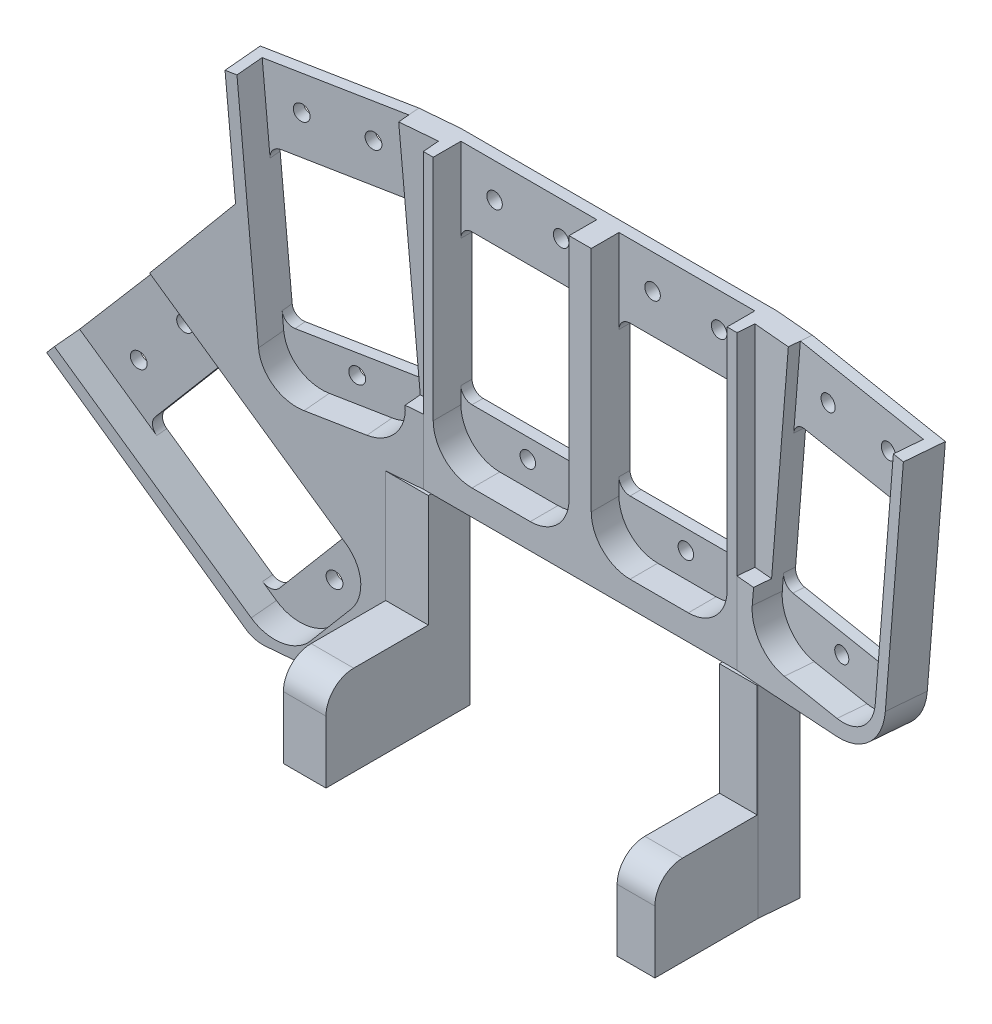
from build123d import *

# Parameters (mm, degrees)
EXTRUDE_3_DEPTH           = 2
EXTRUDE_4_DEPTH           = 5
SKETCH_5_R                = 1.4
CUT_EXTRUDE_1_DEPTH       = 5
EXTRUDE_5_DEPTH           = 52.129230191
SKETCH_8_R                = 1.4
CUT_EXTRUDE_2_DEPTH       = 54
EXTRUDE_6_DEPTH           = 5
EXTRUDE_7_DEPTH           = 52.129230191
EXTRUDE_8_DEPTH           = 5
SKETCH_12_R               = 1.4
CUT_EXTRUDE_3_DEPTH       = 5
EXTRUDE_9_DEPTH           = 48
SKETCH_16_W               = 1.992389396
SKETCH_16_H               = 100.129230191
EXTRUDE_10_DEPTH          = 31
EXTRUDE_12_DEPTH          = 5
SKETCH_20_R               = 1.4
CUT_EXTRUDE_4_DEPTH       = 5
SKETCH_22_R               = 1.4
CUT_EXTRUDE_5_DEPTH       = 126.647084661
CUT_EXTRUDE_6_DEPTH       = 126.647084661
CUT_EXTRUDE_7_DEPTH       = 126.549675565
SKETCH_25_W               = 6.808711464
SKETCH_25_H               = 36.46101183
SKETCH_25_W_2             = 7.679638845
EXTRUDE_14_DEPTH          = 19
CUT_EXTRUDE_8_DEPTH       = 123.081566263
CUT_EXTRUDE_8_DEPTH_BACK  = 123.081566263
SKETCH_26_W               = 24.786483996
SKETCH_26_H               = 10.930361431
SKETCH_26_W_2             = 52.20763572
SKETCH_26_W_3             = 6.238333061
CUT_EXTRUDE_9_DEPTH       = 116.857490947
CUT_EXTRUDE_10_DEPTH      = 118.224183567
CUT_EXTRUDE_11_DEPTH      = 118.323637126
CUT_EXTRUDE_11_DEPTH_BACK = 118.323637126
CUT_EXTRUDE_13_DEPTH      = 118.224183567
CUT_EXTRUDE_13_DEPTH_BACK = 118.224183567
CUT_EXTRUDE_15_DEPTH      = 3
CUT_EXTRUDE_16_DEPTH      = 3
SKETCH_35_W               = 52.511649691
SKETCH_35_H               = 36.46101183
CUT_EXTRUDE_18_DEPTH      = 11
SKETCH_36_R               = 1.4
CUT_EXTRUDE_19_DEPTH      = 5
FILLET_1_R                = 10
SKETCH_37_W               = 18.454216578
SKETCH_37_H               = 20.228048906
CUT_EXTRUDE_20_DEPTH      = 67
FILLET_2_R                = 5


with BuildPart() as part:
    # 草图1 → 凸台-拉伸3 (new body)
    with BuildSketch(Plane.XY):
        with BuildLine():
            ThreePointArc((-6.317132976, 11.564038584), (-6.902919414, 12.978252146), (-8.317132976, 13.564038584))
            Line((-8.317132976, 13.564038584), (-28.817132976, 13.564038584))
            ThreePointArc((-28.817132976, 13.564038584), (-30.231346538, 12.978252146), (-30.817132976, 11.564038584))
            Line((-30.817132976, 11.564038584), (-30.817132976, 26.719925459))
            Line((-30.817132976, 26.719925459), (-6.317132976, 26.719925459))
            Line((-6.317132976, 26.719925459), (-6.317132976, 11.564038584))
        make_face()
        with BuildLine():
            ThreePointArc((22.182867024, 11.564038584), (21.597080586, 12.978252146), (20.182867024, 13.564038584))
            Line((20.182867024, 13.564038584), (-0.317132976, 13.564038584))
            ThreePointArc((-0.317132976, 13.564038584), (-1.731346538, 12.978252146), (-2.317132976, 11.564038584))
            Line((-2.317132976, 11.564038584), (-2.317132976, 26.719925459))
            Line((-2.317132976, 26.719925459), (22.182867024, 26.719925459))
            Line((22.182867024, 26.719925459), (22.182867024, 11.564038584))
        make_face()
        with BuildLine():
            Line((-2.317132976, -11.435961416), (-2.317132976, -14.435961416))
            ThreePointArc((-2.317132976, -14.435961416), (-0.266880444, -19.385708885), (4.682867024, -21.435961416))
            Line((4.682867024, -21.435961416), (15.182867024, -21.435961416))
            ThreePointArc((15.182867024, -21.435961416), (20.132614492, -19.385708885), (22.182867024, -14.435961416))
            Line((22.182867024, -14.435961416), (22.182867024, -11.435961416))
            ThreePointArc((22.182867024, -11.435961416), (21.597080586, -12.850174979), (20.182867024, -13.435961416))
            Line((20.182867024, -13.435961416), (-0.317132976, -13.435961416))
            ThreePointArc((-0.317132976, -13.435961416), (-1.731346538, -12.850174979), (-2.317132976, -11.435961416))
        make_face()
        with BuildLine():
            Line((-30.817132976, -11.435961416), (-30.817132976, -14.435961416))
            ThreePointArc((-30.817132976, -14.435961416), (-28.766880444, -19.385708885), (-23.817132976, -21.435961416))
            Line((-23.817132976, -21.435961416), (-13.317132976, -21.435961416))
            ThreePointArc((-13.317132976, -21.435961416), (-8.367385508, -19.385708885), (-6.317132976, -14.435961416))
            Line((-6.317132976, -14.435961416), (-6.317132976, -11.435961416))
            ThreePointArc((-6.317132976, -11.435961416), (-6.902919414, -12.850174979), (-8.317132976, -13.435961416))
            Line((-8.317132976, -13.435961416), (-28.817132976, -13.435961416))
            ThreePointArc((-28.817132976, -13.435961416), (-30.231346538, -12.850174979), (-30.817132976, -11.435961416))
        make_face()
        with BuildLine():
            ThreePointArc((-2.317132976, -14.435961416), (-0.266880444, -19.385708885), (4.682867024, -21.435961416))
            Line((4.682867024, -21.435961416), (15.182867024, -21.435961416))
            ThreePointArc((15.182867024, -21.435961416), (20.132614492, -19.385708885), (22.182867024, -14.435961416))
            Line((22.182867024, -14.435961416), (22.182867024, -11.435961416))
            Line((22.182867024, -11.435961416), (22.182867024, 11.564038584))
            Line((22.182867024, 11.564038584), (22.182867024, 26.719925459))
            Line((22.182867024, 26.719925459), (24.182867024, 26.719925459))
            Line((24.182867024, 26.719925459), (24.182867024, -25.409304732))
            Line((24.182867024, -25.409304732), (-32.817132976, -25.409304732))
            Line((-32.817132976, -25.409304732), (-32.817132976, 26.719925459))
            Line((-32.817132976, 26.719925459), (-30.817132976, 26.719925459))
            Line((-30.817132976, 26.719925459), (-30.817132976, 11.564038584))
            Line((-30.817132976, 11.564038584), (-30.817132976, -11.435961416))
            Line((-30.817132976, -11.435961416), (-30.817132976, -14.435961416))
            ThreePointArc((-30.817132976, -14.435961416), (-28.766880444, -19.385708885), (-23.817132976, -21.435961416))
            Line((-23.817132976, -21.435961416), (-13.317132976, -21.435961416))
            ThreePointArc((-13.317132976, -21.435961416), (-8.367385508, -19.385708885), (-6.317132976, -14.435961416))
            Line((-6.317132976, -14.435961416), (-6.317132976, -11.435961416))
            Line((-6.317132976, -11.435961416), (-6.317132976, 11.564038584))
            Line((-6.317132976, 11.564038584), (-6.317132976, 26.719925459))
            Line((-6.317132976, 26.719925459), (-2.317132976, 26.719925459))
            Line((-2.317132976, 26.719925459), (-2.317132976, 11.564038584))
            Line((-2.317132976, 11.564038584), (-2.317132976, -11.435961416))
            Line((-2.317132976, -11.435961416), (-2.317132976, -14.435961416))
        make_face()
    extrude(amount=EXTRUDE_3_DEPTH)

    # 草图4 → 凸台-拉伸4 (add)
    with BuildSketch(Plane.XY.offset(2)):
        with BuildLine():
            Line((4.682867024, -21.435961416), (15.182867024, -21.435961416))
            ThreePointArc((15.182867024, -21.435961416), (20.132614492, -19.385708885), (22.182867024, -14.435961416))
            Line((22.182867024, -14.435961416), (22.182867024, -11.435961416))
            Line((22.182867024, -11.435961416), (22.182867024, 11.564038584))
            Line((22.182867024, 11.564038584), (22.182867024, 26.719925459))
            Line((22.182867024, 26.719925459), (24.182867024, 26.719925459))
            Line((24.182867024, 26.719925459), (24.182867024, -25.409304732))
            Line((24.182867024, -25.409304732), (-32.817132976, -25.409304732))
            Line((-32.817132976, -25.409304732), (-32.817132976, 26.719925459))
            Line((-32.817132976, 26.719925459), (-30.817132976, 26.719925459))
            Line((-30.817132976, 26.719925459), (-30.817132976, 11.564038584))
            Line((-30.817132976, 11.564038584), (-30.817132976, -11.435961416))
            Line((-30.817132976, -11.435961416), (-30.817132976, -14.435961416))
            ThreePointArc((-30.817132976, -14.435961416), (-28.766880444, -19.385708885), (-23.817132976, -21.435961416))
            Line((-23.817132976, -21.435961416), (-13.317132976, -21.435961416))
            ThreePointArc((-13.317132976, -21.435961416), (-8.367385508, -19.385708885), (-6.317132976, -14.435961416))
            Line((-6.317132976, -14.435961416), (-6.317132976, -11.435961416))
            Line((-6.317132976, -11.435961416), (-6.317132976, 11.564038584))
            Line((-6.317132976, 11.564038584), (-6.317132976, 26.719925459))
            Line((-6.317132976, 26.719925459), (-2.317132976, 26.719925459))
            Line((-2.317132976, 26.719925459), (-2.317132976, 11.564038584))
            Line((-2.317132976, 11.564038584), (-2.317132976, -11.435961416))
            Line((-2.317132976, -11.435961416), (-2.317132976, -14.435961416))
            ThreePointArc((-2.317132976, -14.435961416), (-0.266880444, -19.385708885), (4.682867024, -21.435961416))
        make_face()
    extrude(amount=EXTRUDE_4_DEPTH)

    # 草图5 → 切除-拉伸1 (cut)
    with BuildSketch(Plane.XY.offset(2)):
        with Locations((9.746956407, -16.935961416)):
            Circle(SKETCH_5_R)
        with Locations((-18.753043593, -16.935961416)):
            Circle(SKETCH_5_R)
        with Locations((-24.753043593, 20.564038584)):
            Circle(SKETCH_5_R)
        with Locations((-12.753043593, 20.564038584)):
            Circle(SKETCH_5_R)
        with Locations((3.746956407, 20.564038584)):
            Circle(SKETCH_5_R)
        with Locations((15.746956407, 20.564038584)):
            Circle(SKETCH_5_R)
    extrude(amount=-CUT_EXTRUDE_1_DEPTH, mode=Mode.SUBTRACT)

    # 草图7 → 凸台-拉伸5 (add)
    with BuildSketch(Plane(origin=(0, 26.719925459, 0), x_dir=(1, 0, 0), z_dir=(0, 1, 0))):
        Polygon((-32.817132976, 0), (-70.226687708, -3.272911947), (-70.05303953, -5.2577197), (-32.817132976, -2), align=None)
    extrude(amount=-EXTRUDE_5_DEPTH)

    # 草图8 → 切除-拉伸2 (cut)
    with BuildSketch(Plane(origin=(-0.075634817, 0, -0.864509916), x_dir=(0.9961946980917453, 0, -0.08715574274766177), z_dir=(0.08715574274766177, 0, 0.9961946980917453))):
        with Locations((-57.531809619, 18.980668109)):
            Circle(SKETCH_8_R)
        with Locations((-45.577473241, 20.026537022)):
            Circle(SKETCH_8_R)
        with Locations((-48.286301077, -17.853698613)):
            Circle(SKETCH_8_R)
        with BuildLine():
            Line((-38.381651523, 11.621711309), (-36.377069439, -11.290766747))
            ThreePointArc((-36.377069439, -11.290766747), (-36.837369949, -12.750653452), (-38.19514735, -13.457467629))
            Line((-38.19514735, -13.457467629), (-58.617138661, -15.244160355))
            ThreePointArc((-58.617138661, -15.244160355), (-60.077025366, -14.783859845), (-60.783839543, -13.426082445))
            Line((-60.783839543, -13.426082445), (-62.788421626, 9.486395612))
            ThreePointArc((-62.788421626, 9.486395612), (-62.328121116, 10.946282316), (-60.970343715, 11.653096493))
            Line((-60.970343715, 11.653096493), (-40.548352404, 13.43978922))
            ThreePointArc((-40.548352404, 13.43978922), (-39.088465699, 12.97948871), (-38.381651523, 11.621711309))
        make_face()
    extrude(amount=-CUT_EXTRUDE_2_DEPTH, mode=Mode.SUBTRACT)

    # 草图9 → 凸台-拉伸6 (add)
    with BuildSketch(Plane(origin=(-0.075634817, 0, -0.864509916), x_dir=(0.9961946980917453, 0, -0.08715574274766177), z_dir=(0.08715574274766177, 0, 0.9961946980917453))):
        with BuildLine():
            Line((-39.7025741, 26.719925459), (-38.381651523, 11.621711309))
            Line((-38.381651523, 11.621711309), (-36.377069439, -11.290766747))
            Line((-36.377069439, -11.290766747), (-36.115602211, -14.279350842))
            ThreePointArc((-36.115602211, -14.279350842), (-37.726653996, -19.388954309), (-42.478874898, -21.862803927))
            Line((-42.478874898, -21.862803927), (-52.938919228, -22.777939226))
            ThreePointArc((-52.938919228, -22.777939226), (-58.048522695, -21.166887441), (-60.522372314, -16.414666539))
            Line((-60.522372314, -16.414666539), (-60.783839543, -13.426082445))
            Line((-60.783839543, -13.426082445), (-62.788421626, 9.486395612))
            Line((-62.788421626, 9.486395612), (-64.29616012, 26.719925459))
            Line((-64.29616012, 26.719925459), (-66.29616012, 26.719925459))
            Line((-66.29616012, 26.719925459), (-61.73544344, -25.409304732))
            Line((-61.73544344, -25.409304732), (-32.866565363, -25.409304732))
            Line((-32.866565363, -25.409304732), (-32.866565363, 26.719925459))
            Line((-32.866565363, 26.719925459), (-39.7025741, 26.719925459))
        make_face()
    extrude(amount=EXTRUDE_6_DEPTH)

    # 草图10 → 凸台-拉伸7 (add)
    with BuildSketch(Plane(origin=(0, 26.719925459, 0), x_dir=(1, 0, 0), z_dir=(0, 1, 0))):
        Polygon((24.182867024, 0), (76.130717626, -4.544848022), (76.172198029, -6.548477087), (24.182867024, -2), align=None)
    extrude(amount=-EXTRUDE_7_DEPTH)

    # 草图11 → 凸台-拉伸8 (add)
    with BuildSketch(Plane(origin=(0.010047867, 0, -0.114847642), x_dir=(0.9961946980917452, 0, 0.08715574274766201), z_dir=(-0.08715574274766202, 0, 0.9961946980917453))):
        with BuildLine():
            Line((27.775659476, -11.290766747), (29.780241559, 11.621711309))
            Line((29.780241559, 11.621711309), (31.101164137, 26.719925459))
            Line((31.101164137, 26.719925459), (24.265155399, 26.719925459))
            Line((24.265155399, 26.719925459), (24.265155399, -25.409304732))
            Line((24.265155399, -25.409304732), (53.134033476, -25.409304732))
            Line((53.134033476, -25.409304732), (57.694750156, 26.719925459))
            Line((57.694750156, 26.719925459), (55.694750156, 26.719925459))
            Line((55.694750156, 26.719925459), (54.187011662, 9.486395612))
            Line((54.187011662, 9.486395612), (52.182429579, -13.426082445))
            Line((52.182429579, -13.426082445), (51.920962351, -16.414666539))
            ThreePointArc((51.920962351, -16.414666539), (49.447112732, -21.166887441), (44.337509265, -22.777939226))
            Line((44.337509265, -22.777939226), (33.877464935, -21.862803927))
            ThreePointArc((33.877464935, -21.862803927), (29.125244032, -19.388954309), (27.514192248, -14.279350842))
            Line((27.514192248, -14.279350842), (27.775659476, -11.290766747))
        make_face()
    extrude(amount=EXTRUDE_8_DEPTH)

    # 草图12 → 切除-拉伸3 (cut)
    with BuildSketch(Plane(origin=(0.010047867, 0, -0.114847642), x_dir=(0.9961946980917452, 0, 0.08715574274766201), z_dir=(-0.08715574274766202, 0, 0.9961946980917453))):
        with Locations((36.605656936, 20.058943377)):
            Circle(SKETCH_12_R)
        with Locations((48.559993313, 19.013074464)):
            Circle(SKETCH_12_R)
        with Locations((39.314484771, -17.821292257)):
            Circle(SKETCH_12_R)
        with BuildLine():
            Line((50.015728697, -15.244160355), (29.593737387, -13.457467629))
            ThreePointArc((29.593737387, -13.457467629), (28.235959986, -12.750653452), (27.775659476, -11.290766747))
            Line((27.775659476, -11.290766747), (29.780241559, 11.621711309))
            ThreePointArc((29.780241559, 11.621711309), (30.487055736, 12.97948871), (31.946942441, 13.43978922))
            Line((31.946942441, 13.43978922), (52.368933752, 11.653096493))
            ThreePointArc((52.368933752, 11.653096493), (53.726711152, 10.946282316), (54.187011662, 9.486395612))
            Line((54.187011662, 9.486395612), (52.182429579, -13.426082445))
            ThreePointArc((52.182429579, -13.426082445), (51.475615402, -14.783859845), (50.015728697, -15.244160355))
        make_face()
    extrude(amount=-CUT_EXTRUDE_3_DEPTH, mode=Mode.SUBTRACT)

    # 草图14 → 凸台-拉伸9 (add)
    with BuildSketch(Plane.XZ.offset(25.409304732)):
        Polygon((52.50611159, 9.497062002), (23.964562309, 7), (-32.598828262, 7), (-61.140377543, 9.497062002), (-61.576156256, 4.516088511), (-70.05303953, 5.2577197), (-70.226687708, 3.272911947), (-32.817132976, 0), (24.182867024, 0), (76.130717626, 4.544848022), (76.172198029, 6.548477087), (52.941890304, 4.516088511), align=None)
    extrude(amount=EXTRUDE_9_DEPTH)

    # 草图16 → 凸台-拉伸10 (add)
    with BuildSketch(Plane(origin=(-69.977404713, 0, 6.122229615), x_dir=(0.0871557427476607, 0, 0.9961946980917453), z_dir=(-0.9961946980917453, 0, 0.0871557427476607))):
        with Locations((-1.864006901, -23.344689637)):
            Rectangle(SKETCH_16_W, SKETCH_16_H)
    extrude(amount=EXTRUDE_10_DEPTH)

    # 草图19 → 凸台-拉伸12 (add)
    with BuildSketch(Plane(origin=(-0.075634817, 0, -0.864509916), x_dir=(0.9961946980917453, 0, -0.08715574274766177), z_dir=(0.08715574274766177, 0, 0.9961946980917453))):
        Polygon((-66.29616012, 26.719925459), (-101.244707031, 26.719925459), (-101.244707031, -73.409304732), (-61.73544344, -73.409304732), (-61.73544344, -25.409304732), align=None)
    extrude(amount=EXTRUDE_12_DEPTH)

    # 草图20 → 切除-拉伸4 (cut)
    # profile 1 of 6: a face of its own
    with BuildSketch(Plane(origin=(0.360143897, 0, 4.116463575), x_dir=(0.9961946980917453, 0, -0.08715574274766179), z_dir=(0.08715574274766179, 0, 0.9961946980917453))):
        with BuildLine():
            Line((-65.907799812, -23.656490776), (-48.28877762, -38.440605799))
            ThreePointArc((-48.28877762, -38.440605799), (-47.581963443, -39.7983832), (-48.042263953, -41.258269905))
            Line((-48.042263953, -41.258269905), (-61.219409952, -56.962180988))
            ThreePointArc((-61.219409952, -56.962180988), (-62.577187353, -57.668995165), (-64.037074057, -57.208694655))
            Line((-64.037074057, -57.208694655), (-81.656096249, -42.424579633))
            ThreePointArc((-81.656096249, -42.424579633), (-82.362910426, -41.066802232), (-81.902609916, -39.606915527))
            Line((-81.902609916, -39.606915527), (-68.725463917, -23.903004443))
            ThreePointArc((-68.725463917, -23.903004443), (-67.367686517, -23.196190266), (-65.907799812, -23.656490776))
        make_face()
    # profile 2 of 6: a face of its own
    with BuildSketch(Plane(origin=(0.360143897, 0, 4.116463575), x_dir=(0.9961946980917453, 0, -0.08715574274766179), z_dir=(0.08715574274766179, 0, 0.9961946980917453))):
        with BuildLine():
            ThreePointArc((-65.907799812, -23.656490776), (-67.367686517, -23.196190266), (-68.725463917, -23.903004443))
            Line((-68.725463917, -23.903004443), (-81.902609916, -39.606915527))
            ThreePointArc((-81.902609916, -39.606915527), (-82.362910426, -41.066802232), (-81.656096249, -42.424579633))
            Line((-81.656096249, -42.424579633), (-94.497779755, -31.649127739))
            Line((-94.497779755, -31.649127739), (-78.647244674, -12.966827291))
            Line((-78.647244674, -12.966827291), (-65.907799812, -23.656490776))
        make_face()
        with Locations((-84.652574718, -31.994129171)):
            Circle(SKETCH_20_R, mode=Mode.SUBTRACT)
        with Locations((-76.939123402, -22.801595854)):
            Circle(SKETCH_20_R, mode=Mode.SUBTRACT)
    # profile 3 of 6: a face of its own
    with BuildSketch(Plane(origin=(0.360143897, 0, 4.116463575), x_dir=(0.9961946980917453, 0, -0.08715574274766179), z_dir=(0.08715574274766179, 0, 0.9961946980917453))):
        with Locations((-84.652574718, -31.994129171)):
            Circle(SKETCH_20_R)
    # profile 4 of 6: a face of its own
    with BuildSketch(Plane(origin=(0.360143897, 0, 4.116463575), x_dir=(0.9961946980917453, 0, -0.08715574274766179), z_dir=(0.08715574274766179, 0, 0.9961946980917453))):
        with Locations((-76.939123402, -22.801595854)):
            Circle(SKETCH_20_R)
    # profile 5 of 6: a face of its own
    with BuildSketch(Plane(origin=(0.360143897, 0, 4.116463575), x_dir=(0.9961946980917453, 0, -0.08715574274766179), z_dir=(0.08715574274766179, 0, 0.9961946980917453))):
        with BuildLine():
            Line((-64.037074057, -57.208694655), (-61.738940728, -59.137057484))
            ThreePointArc((-61.738940728, -59.137057484), (-56.629337261, -60.748109269), (-51.877116358, -58.27425965))
            Line((-51.877116358, -58.27425965), (-45.127846457, -50.230792998))
            ThreePointArc((-45.127846457, -50.230792998), (-43.516794672, -45.121189531), (-45.990644291, -40.368968628))
            Line((-45.990644291, -40.368968628), (-48.28877762, -38.440605799))
            ThreePointArc((-48.28877762, -38.440605799), (-47.581963443, -39.7983832), (-48.042263953, -41.258269905))
            Line((-48.042263953, -41.258269905), (-61.219409952, -56.962180988))
            ThreePointArc((-61.219409952, -56.962180988), (-62.577187353, -57.668995165), (-64.037074057, -57.208694655))
        make_face()
        with Locations((-52.069182443, -51.502397876)):
            Circle(SKETCH_20_R, mode=Mode.SUBTRACT)
    # profile 6 of 6: a face of its own
    with BuildSketch(Plane(origin=(0.360143897, 0, 4.116463575), x_dir=(0.9961946980917453, 0, -0.08715574274766179), z_dir=(0.08715574274766179, 0, 0.9961946980917453))):
        with Locations((-52.069182443, -51.502397876)):
            Circle(SKETCH_20_R)
    extrude(amount=-CUT_EXTRUDE_4_DEPTH, mode=Mode.SUBTRACT)

    # 草图22 → 切除-拉伸5 (cut, through all)
    with BuildSketch(Plane(origin=(-0.075634817, 0, -0.864509916), x_dir=(0.9961946980917453, 0, -0.08715574274766179), z_dir=(0.08715574274766179, 0, 0.9961946980917453))):
        with Locations((-76.939123402, -22.801595854)):
            Circle(SKETCH_22_R)
        with Locations((-84.652574718, -31.994129171)):
            Circle(SKETCH_22_R)
        with Locations((-52.069182443, -51.502397876)):
            Circle(SKETCH_22_R)
    extrude(amount=-CUT_EXTRUDE_5_DEPTH, mode=Mode.SUBTRACT)

    # 草图23 → 切除-拉伸6 (cut, through all)
    with BuildSketch(Plane(origin=(-0.075634817, 0, -0.864509916), x_dir=(0.9961946980917453, 0, -0.08715574274766179), z_dir=(0.08715574274766179, 0, 0.9961946980917453))):
        with BuildLine():
            Line((-48.042263953, -41.258269905), (-61.219409952, -56.962180988))
            ThreePointArc((-61.219409952, -56.962180988), (-62.577187353, -57.668995165), (-64.037074057, -57.208694655))
            Line((-64.037074057, -57.208694655), (-81.656096249, -42.424579633))
            ThreePointArc((-81.656096249, -42.424579633), (-82.362910426, -41.066802232), (-81.902609916, -39.606915527))
            Line((-81.902609916, -39.606915527), (-68.725463917, -23.903004443))
            ThreePointArc((-68.725463917, -23.903004443), (-67.367686517, -23.196190266), (-65.907799812, -23.656490776))
            Line((-65.907799812, -23.656490776), (-48.28877762, -38.440605799))
            ThreePointArc((-48.28877762, -38.440605799), (-47.581963443, -39.7983832), (-48.042263953, -41.258269905))
        make_face()
    extrude(amount=-CUT_EXTRUDE_6_DEPTH, mode=Mode.SUBTRACT)

    # 草图24 → 切除-拉伸7 (cut, through all)
    with BuildSketch(Plane(origin=(0.360143897, 0, 4.116463575), x_dir=(0.9961946980917453, 0, -0.08715574274766179), z_dir=(0.08715574274766179, 0, 0.9961946980917453))):
        Polygon((-78.647244674, -12.966827291), (-94.497779755, -31.649127739), (-95.791681788, -33.174190862), (-48.368394056, -73.409304732), (-101.244707031, -73.409304732), (-101.244707031, 26.719925459), (-66.29616012, 26.719925459), (-64.33890811, 4.348432612), align=None)
    extrude(amount=-CUT_EXTRUDE_7_DEPTH, mode=Mode.SUBTRACT)

    # 草图25 → 凸台-拉伸14 (add)
    with BuildSketch(Plane.XY.offset(7)):
        with Locations((24.758482945, -44.248437386)):
            Rectangle(SKETCH_25_W, SKETCH_25_H)
        with Locations((-34.997341901, -44.248437386)):
            Rectangle(SKETCH_25_W_2, SKETCH_25_H)
    extrude(amount=EXTRUDE_14_DEPTH)

    # 草图26 → 切除-拉伸8 (cut, two sides: drawn at the far end of the back side and taken through both)
    with BuildSketch(Plane.XY.offset(7).offset(-CUT_EXTRUDE_8_DEPTH_BACK)):
        with Locations((-51.230403321, -67.944124017)):
            Rectangle(SKETCH_26_W, SKETCH_26_H)
        Polygon((-31.157522478, -62.478943301), (-32.598828262, -62.478943301), (-32.598828262, -73.409304732), (23.964562309, -73.409304732), (23.964562309, -62.478943301), (21.354127213, -62.478943301), align=None)
        with Locations((50.068380169, -67.944124017)):
            Rectangle(SKETCH_26_W_2, SKETCH_26_H)
        with Locations((-35.717994793, -67.944124017)):
            Rectangle(SKETCH_26_W_3, SKETCH_26_H)
    extrude(amount=CUT_EXTRUDE_8_DEPTH + CUT_EXTRUDE_8_DEPTH_BACK, mode=Mode.SUBTRACT)

    # 草图27 → 切除-拉伸9 (cut, through all)
    with BuildSketch(Plane(origin=(-0.425730847, 0, 4.866125849), x_dir=(0.9961946980917452, 0, 0.08715574274766202), z_dir=(-0.08715574274766204, 0, 0.9961946980917453))):
        Polygon((53.134033476, -25.409304732), (28.697773215, -26.017931471), (28.697773215, -62.478943301), (53.134033476, -62.478943301), align=None)
    extrude(amount=-CUT_EXTRUDE_9_DEPTH, mode=Mode.SUBTRACT)

    # 草图28 → 切除-拉伸10 (cut, through all)
    with BuildSketch(Plane(origin=(0.010047867, 0, -0.114847642), x_dir=(0.9961946980917452, 0, 0.08715574274766201), z_dir=(-0.08715574274766202, 0, 0.9961946980917453))):
        Polygon((76.453077203, -62.478943301), (76.453077203, 26.719925459), (57.694750156, 26.719925459), (53.134033476, -25.409304732), (53.134033476, -62.478943301), align=None)
    extrude(amount=-CUT_EXTRUDE_10_DEPTH, mode=Mode.SUBTRACT)

    # 草图29 → 切除-拉伸11 (cut, two sides: drawn at the far end of the back side and taken through both)
    with BuildSketch(Plane(origin=(-0.075634817, 0, -0.864509916), x_dir=(0.9961946980917453, 0, -0.08715574274766177), z_dir=(0.08715574274766177, 0, 0.9961946980917453)).offset(-CUT_EXTRUDE_11_DEPTH_BACK)):
        Polygon((-39.7025741, 26.719925459), (-66.094151956, 24.410961584), (-66.29616012, 26.719925459), align=None)
    extrude(amount=CUT_EXTRUDE_11_DEPTH + CUT_EXTRUDE_11_DEPTH_BACK, mode=Mode.SUBTRACT)

    # 草图31 → 切除-拉伸13 (cut, two sides: drawn at the far end of the back side and taken through both)
    with BuildSketch(Plane(origin=(0.010047867, 0, -0.114847642), x_dir=(0.9961946980917452, 0, 0.08715574274766201), z_dir=(-0.08715574274766202, 0, 0.9961946980917453)).offset(-CUT_EXTRUDE_13_DEPTH_BACK)):
        Polygon((31.101164137, 26.719925459), (57.492741993, 24.410961584), (57.694750156, 26.719925459), align=None)
    extrude(amount=CUT_EXTRUDE_13_DEPTH + CUT_EXTRUDE_13_DEPTH_BACK, mode=Mode.SUBTRACT)

    # 草图33 → 切除-拉伸15 (cut)
    with BuildSketch(Plane(origin=(0.360143897, 0, 4.116463575), x_dir=(0.9961946980917453, 0, -0.08715574274766179), z_dir=(0.08715574274766179, 0, 0.9961946980917453))):
        Polygon((-39.7025741, 26.719925459), (-33.084870077, 26.719925459), (-33.084870077, -14.279350842), (-36.115602211, -14.279350842), align=None)
    extrude(amount=-CUT_EXTRUDE_15_DEPTH, mode=Mode.SUBTRACT)

    # 草图34 → 切除-拉伸16 (cut)
    with BuildSketch(Plane(origin=(-0.425730847, 0, 4.866125849), x_dir=(0.9961946980917452, 0, 0.08715574274766202), z_dir=(-0.08715574274766204, 0, 0.9961946980917453))):
        Polygon((31.101164137, 26.719925459), (27.775659476, -11.290766747), (24.483460114, -11.290766747), (24.483460114, 26.719925459), align=None)
    extrude(amount=-CUT_EXTRUDE_16_DEPTH, mode=Mode.SUBTRACT)

    # 草图35 → 切除-拉伸18 (cut)
    with BuildSketch(Plane.XY.offset(7)):
        with Locations((-4.901697632, -44.248437386)):
            Rectangle(SKETCH_35_W, SKETCH_35_H)
    extrude(amount=-CUT_EXTRUDE_18_DEPTH, mode=Mode.SUBTRACT)

    # 草图36 → 切除-拉伸19 (cut)
    with BuildSketch(Plane.XZ.offset(62.478943301)):
        with Locations(Location((25.048382297, 3, 0), (0, 0, 270))):
            Circle(SKETCH_36_R)
        with Locations(Location((25.048382297, 21, 0), (0, 0, 270))):
            Circle(SKETCH_36_R)
        with Locations(Location((-35.951617703, 3, 0), (0, 0, 270))):
            Circle(SKETCH_36_R)
        with Locations(Location((-35.951617703, 21, 0), (0, 0, 270))):
            Circle(SKETCH_36_R)
    extrude(amount=-CUT_EXTRUDE_19_DEPTH, mode=Mode.SUBTRACT)

    # 圆角1
    fillet_1_edges = [part.edges().sort_by_distance(p)[0] for p in [
        (52.810825036, -25.409304732, 6.01417138),
    ]]
    fillet(fillet_1_edges, radius=FILLET_1_R)

    # 草图37 → 切除-拉伸20 (cut)
    with BuildSketch(Plane.ZY.offset(38.837161323)):
        with Locations((16.772891711, -36.131955924)):
            Rectangle(SKETCH_37_W, SKETCH_37_H)
    extrude(amount=-CUT_EXTRUDE_20_DEPTH, mode=Mode.SUBTRACT)

    # 圆角2
    fillet_2_edges = [part.edges().sort_by_distance(p)[0] for p in [
        (-60.963000005, -62.478943301, 5.971993884),
        (-34.997341901, -46.245980377, 26),
        (24.758482945, -46.245980377, 26),
    ]]
    fillet(fillet_2_edges, radius=FILLET_2_R)


solid = part.part
